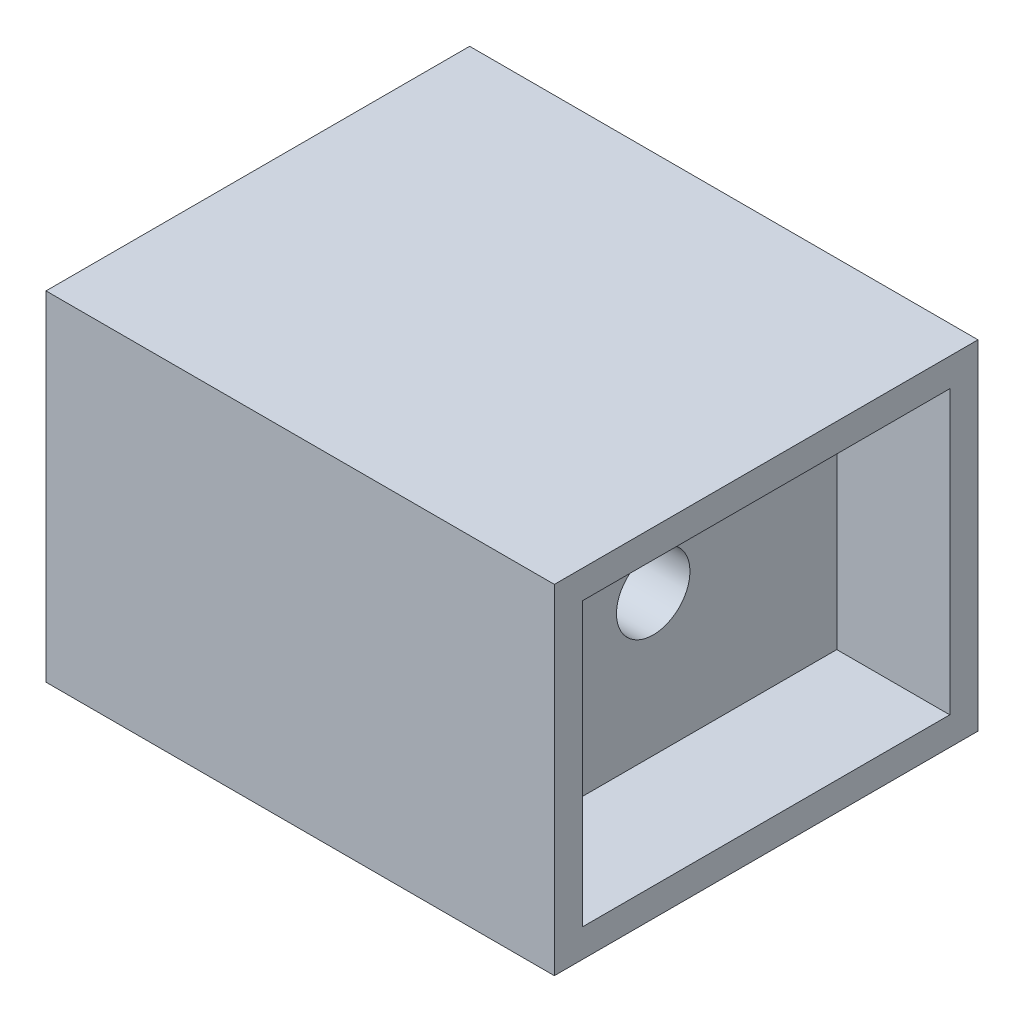
from build123d import *

# Parameters (mm, degrees)
ESQUISSE1_W             = 15
ESQUISSE1_H             = 12
BOSS_EXTRU_1_DEPTH      = 4
ESQUISSE2_W             = 1
ESQUISSE2_H             = 12
BOSS_EXTRU_2_DEPTH      = 4
ESQUISSE3_W             = 13
ESQUISSE3_H             = 1
BOSS_EXTRU_3_DEPTH      = 4
ESQUISSE4_R             = 1.3
ENL_V_MAT_EXTRU_1_DEPTH = 21.808652047
ESQUISSE5_R             = 2.5
ENL_V_MAT_EXTRU_2_DEPTH = 1.5
CHANFREIN1_SIZE         = 1
ESQUISSE6_W             = 11
ESQUISSE6_H             = 8
BOSS_EXTRU_4_DEPTH      = 10
ESQUISSE7_W             = 11.2
ESQUISSE7_H             = 8.2
ENL_V_MAT_EXTRU_3_DEPTH = 10


with BuildPart() as part:
    # Esquisse1 → Boss.-Extru.1 (new body)
    with BuildSketch(Plane(origin=(0, 0, 0), x_dir=(0, 0, -1), z_dir=(1, 0, 0))):
        with Locations((7.5, 6)):
            Rectangle(ESQUISSE1_W, ESQUISSE1_H)
    extrude(amount=BOSS_EXTRU_1_DEPTH)

    # Esquisse2 → Boss.-Extru.2 (add)
    with BuildSketch(Plane(origin=(4, 0, 0), x_dir=(0, 0, -1), z_dir=(1, 0, 0))):
        with Locations((0.5, 6)):
            Rectangle(ESQUISSE2_W, ESQUISSE2_H)
        with Locations((14.5, 6)):
            Rectangle(ESQUISSE2_W, ESQUISSE2_H)
    extrude(amount=BOSS_EXTRU_2_DEPTH)

    # Esquisse3 → Boss.-Extru.3 (add)
    with BuildSketch(Plane(origin=(4, 0, 0), x_dir=(0, 0, -1), z_dir=(1, 0, 0))):
        with Locations((7.5, 11.5)):
            Rectangle(ESQUISSE3_W, ESQUISSE3_H)
        with Locations((7.5, 0.5)):
            Rectangle(ESQUISSE3_W, ESQUISSE3_H)
    extrude(amount=BOSS_EXTRU_3_DEPTH)

    # Esquisse4 → Enlèv. mat.-Extru.1 (cut, through all)
    with BuildSketch(Plane.ZY):
        with Locations((-7.5, 6)):
            Circle(ESQUISSE4_R)
    extrude(amount=-ENL_V_MAT_EXTRU_1_DEPTH, mode=Mode.SUBTRACT)

    # Esquisse5 → Enlèv. mat.-Extru.2 (cut)
    with BuildSketch(Plane.ZY):
        with Locations((-7.5, 6)):
            Circle(ESQUISSE5_R)
    extrude(amount=-ENL_V_MAT_EXTRU_2_DEPTH, mode=Mode.SUBTRACT)

    # Chanfrein1
    chanfrein1_edges = [part.edges().sort_by_distance(p)[0] for p in [
        (0, 6, -10),
    ]]
    chamfer(chanfrein1_edges, length=CHANFREIN1_SIZE)

    # Esquisse6 → Boss.-Extru.4 (add)
    with BuildSketch(Plane.ZY):
        Polygon((-2, 0), (0, 0), (0, 2), (0, 10), (0, 12), (-2, 12), (-13, 12), (-15, 12), (-15, 10), (-15, 2), (-15, 0), (-13, 0), align=None)
        with Locations((-7.5, 6)):
            Rectangle(ESQUISSE6_W, ESQUISSE6_H, mode=Mode.SUBTRACT)
    extrude(amount=BOSS_EXTRU_4_DEPTH)

    # Esquisse7 → Enlèv. mat.-Extru.3 (cut)
    with BuildSketch(Plane.ZY.offset(10)):
        with Locations((-7.5, 6)):
            Rectangle(ESQUISSE7_W, ESQUISSE7_H)
    extrude(amount=-ENL_V_MAT_EXTRU_3_DEPTH, mode=Mode.SUBTRACT)


solid = part.part
